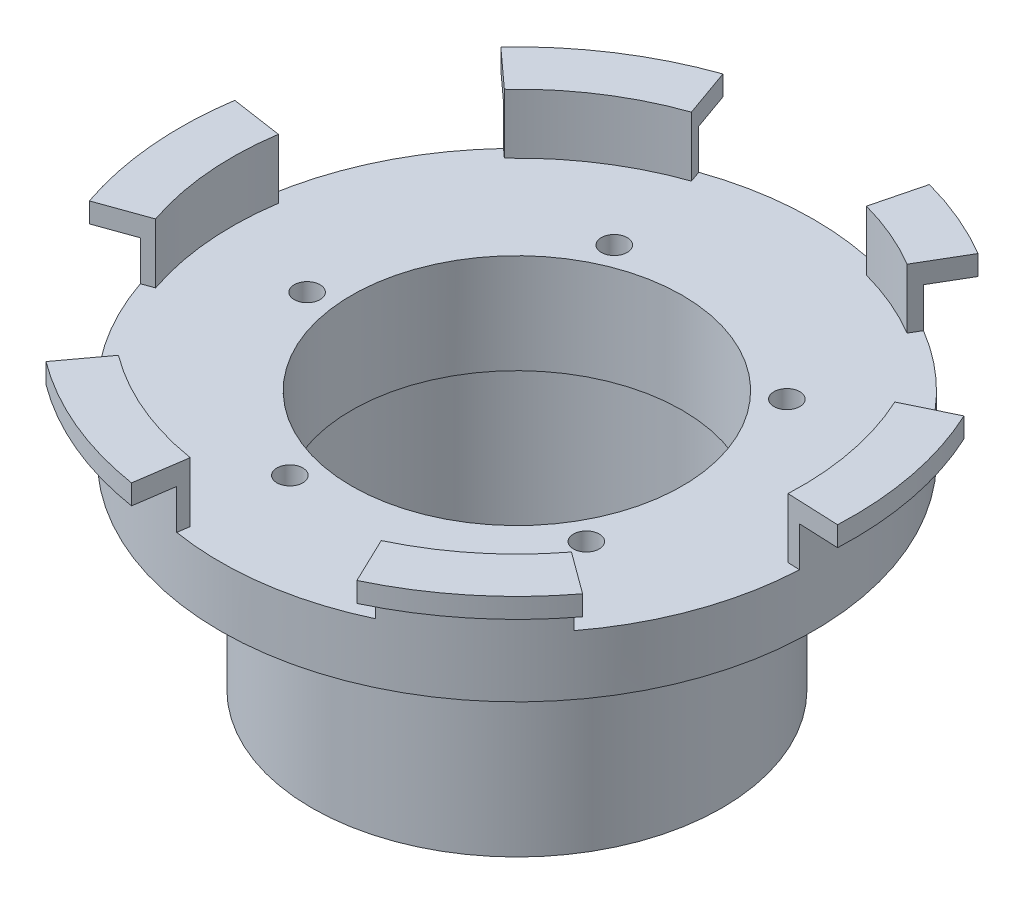
from build123d import *
from build123d.topology import SkipClean

# Parameters (mm, degrees)
SKETCH1_R           = 71.5
SKETCH1_R_2         = 41.5
SKETCH1_R_3         = 3.25
BOSS_EXTRUDE1_DEPTH = 15
SKETCH3_R           = 74.5
SKETCH3_R_2         = 71.5
BOSS_EXTRUDE2_DEPTH = 30
BOSS_EXTRUDE3_START = -5
SKETCH4_R           = 84.5
SKETCH4_R_2         = 74.5
BOSS_EXTRUDE3_DEPTH = 5
BOSS_EXTRUDE4_START = 50
SKETCH5_R           = 51.5
SKETCH5_R_2         = 41.5
BOSS_EXTRUDE4_DEPTH = 50
SKETCH6_R           = 44.5
SKETCH6_R_2         = 41.5
CUT_EXTRUDE1_DEPTH  = 40
CUT_EXTRUDE3_REACH  = 159.061
CIRPATTERN1_COUNT   = 6
CIRPATTERN1_ANGLE   = 310


with BuildPart() as part:
    # Sketch1 → Boss-Extrude1 (new body)
    with BuildSketch(Plane(origin=(0, 0, 0), x_dir=(1, 0, 0), z_dir=(0, 1, 0))):
        with Locations(Location((-1.336232833, 19.905228099, 0), (0, 0, 270))):
            Circle(SKETCH1_R)
        with Locations(Location((-1.336232833, 19.905228099, 0), (0, 0, 270))):
            Circle(SKETCH1_R_2, mode=Mode.SUBTRACT)
        with Locations(Location((40.185857772, -4.176216869, 0), (0, 0, 270))):
            Circle(SKETCH1_R_3, mode=Mode.SUBTRACT)
        with Locations(Location((34.397613964, 51.953507196, 0), (0, 0, 270))):
            Circle(SKETCH1_R_3, mode=Mode.SUBTRACT)
        with Locations(Location((-20.773591569, 63.793598829, 0), (0, 0, 270))):
            Circle(SKETCH1_R_3, mode=Mode.SUBTRACT)
        with Locations(Location((-49.083027981, 14.981453825, 0), (0, 0, 270))):
            Circle(SKETCH1_R_3, mode=Mode.SUBTRACT)
        with Locations(Location((-11.408016353, -27.026202486, 0), (0, 0, 270))):
            Circle(SKETCH1_R_3, mode=Mode.SUBTRACT)
    extrude(amount=BOSS_EXTRUDE1_DEPTH)

    # Sketch3 → Boss-Extrude2 (add)
    with BuildSketch(Plane.XZ):
        with Locations(Location((-1.336232833, -19.905228099, 0), (0, 0, 270))):
            Circle(SKETCH3_R)
        with Locations(Location((-1.336232833, -19.905228099, 0), (0, 0, 270))):
            Circle(SKETCH3_R_2, mode=Mode.SUBTRACT)
    extrude(amount=-BOSS_EXTRUDE2_DEPTH)

    # Sketch4 → Boss-Extrude3 (add)
    with BuildSketch(Plane(origin=(0, 30, 0), x_dir=(1, 0, 0), z_dir=(0, 1, 0)).offset(BOSS_EXTRUDE3_START)):
        with Locations(Location((-1.336232833, 19.905228099, 0), (0, 0, 270))):
            Circle(SKETCH4_R)
        with Locations(Location((-1.336232833, 19.905228099, 0), (0, 0, 90))):
            Circle(SKETCH4_R_2, mode=Mode.SUBTRACT)
    extrude(amount=BOSS_EXTRUDE3_DEPTH)

    # Sketch5 → Boss-Extrude4 (add)
    with SkipClean():  # the faces are left unmerged after this step: merging them gives an invalid solid
        with BuildSketch(Plane.XZ.offset(BOSS_EXTRUDE4_START)):
            with Locations(Location((-1.336232833, -19.905228099, 0), (0, 0, 270))):
                Circle(SKETCH5_R)
            with Locations(Location((-1.336232833, -19.905228099, 0), (0, 0, 270))):
                Circle(SKETCH5_R_2, mode=Mode.SUBTRACT)
        extrude(amount=-BOSS_EXTRUDE4_DEPTH)

    # Sketch6 → Cut-Extrude1 (cut)
    with SkipClean():  # the faces are left unmerged after this step: merging them gives an invalid solid
        with BuildSketch(Plane.XZ.offset(50)):
            with Locations(Location((-1.336232833, -19.905228099, 0), (0, 0, 270))):
                Circle(SKETCH6_R)
            with Locations(Location((-1.336232833, -19.905228099, 0), (0, 0, 270))):
                Circle(SKETCH6_R_2, mode=Mode.SUBTRACT)
        extrude(amount=-CUT_EXTRUDE1_DEPTH, mode=Mode.SUBTRACT)

    # Cut-Extrude3: up to this face of the body (flat: up to its plane)
    cut_extrude3_end = Plane(part.part.faces().sort_by_distance((-1.336232833, 15, 49.572446507))[0])
    # Sketch7 → Cut-Extrude3 (cut, up to the picked face)
    with BuildSketch(Plane(origin=(0, 30, 0), x_dir=(1, 0, 0), z_dir=(0, 1, 0)), mode=Mode.PRIVATE) as cut_extrude3_sk1:
        with BuildLine():
            Line((19.950155792, 55.530214545), (41.736818688, 92.602973818))
            ThreePointArc((41.736818688, 92.602973818), (61.316730337, 76.60493009), (75.28693821, 55.530214545))
            Line((75.28693821, 55.530214545), (36.551951119, 36.83849467))
            ThreePointArc((36.551951119, 36.83849467), (29.69202216, 47.464208343), (19.950155792, 55.530214545))
        make_face()
    cut_extrude3_tool1 = split(extrude(cut_extrude3_sk1.sketch, amount=-CUT_EXTRUDE3_REACH, mode=Mode.PRIVATE), bisect_by=cut_extrude3_end, keep=Keep.BOTH, mode=Mode.PRIVATE)
    cut_extrude3 = cut_extrude3_tool1.solids().sort_by(Axis((46.525218, 30, -62.990875), (0, -1, 0)))[0]
    add(cut_extrude3, mode=Mode.SUBTRACT)

    # CirPattern1: Cut-Extrude3 ×6 about axis
    with SkipClean():  # the faces are left unmerged after this step: merging them gives an invalid solid
        cirpattern1_axis = Axis((-1.336232833, 0, -19.905228099), (0, -1, 0))
        for i in range(1, CIRPATTERN1_COUNT):
            add(cut_extrude3.rotate(cirpattern1_axis, i * CIRPATTERN1_ANGLE / (CIRPATTERN1_COUNT - 1)), mode=Mode.SUBTRACT)


solid = part.part
